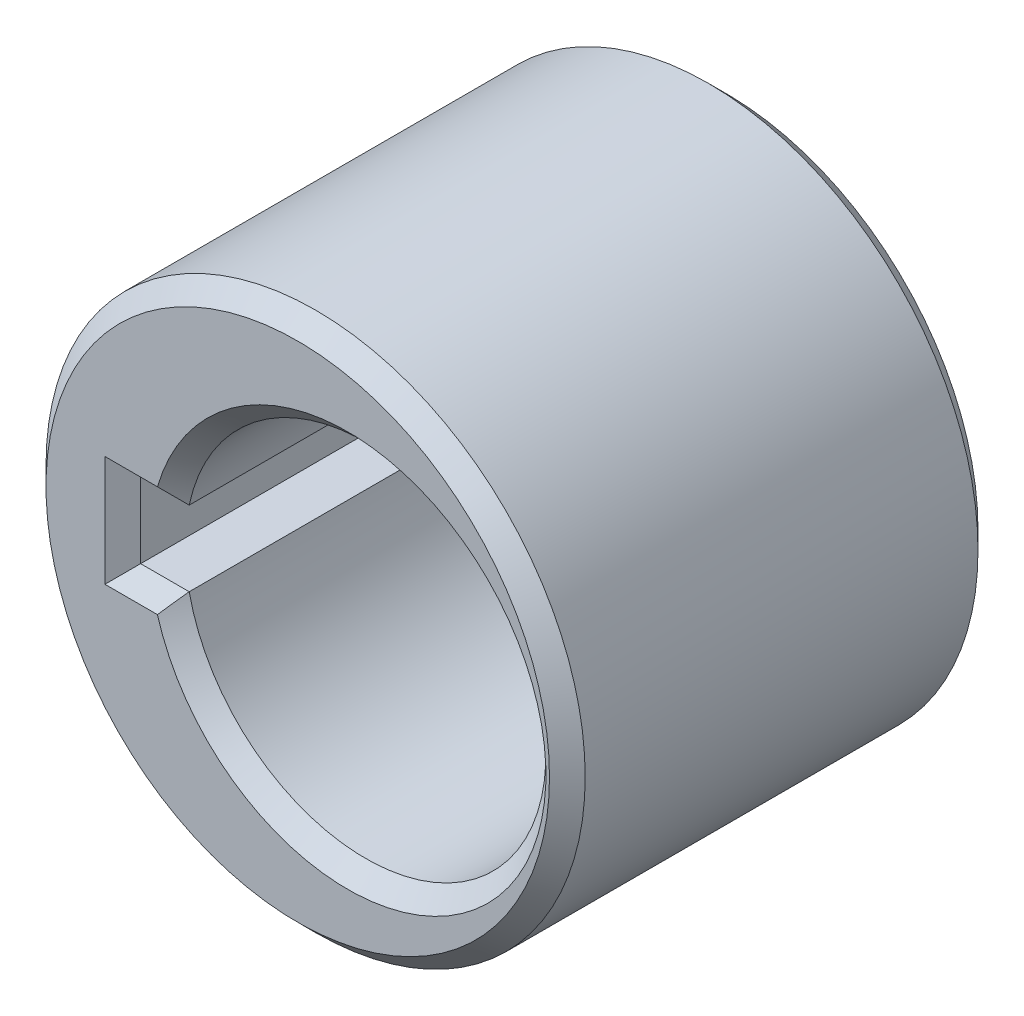
from build123d import *

# Parameters (mm, degrees)
SKETCH1_R           = 7.55
SKETCH1_R_2         = 5.05
BOSS_EXTRUDE1_DEPTH = 12
SKETCH2_W           = 6.3
SKETCH2_H           = 2.1
CUT_EXTRUDE1_DEPTH  = 17.766186209
CHAMFER1_SIZE       = 0.5
CHAMFER2_SIZE       = 0.5
CHAMFER3_SIZE       = 0.5


with BuildPart() as part:
    # Sketch1 → Boss-Extrude1 (new body)
    with BuildSketch(Plane.XY):
        with Locations((-1.4, 0)):
            Circle(SKETCH1_R)
        Circle(SKETCH1_R_2, mode=Mode.SUBTRACT)
    extrude(amount=BOSS_EXTRUDE1_DEPTH)

    # Sketch2 → Cut-Extrude1 (cut, through all)
    with BuildSketch(Plane.XY.offset(12)):
        with Locations((-3.15, 0)):
            Rectangle(SKETCH2_W, SKETCH2_H)
    extrude(amount=-CUT_EXTRUDE1_DEPTH, mode=Mode.SUBTRACT)

    # Chamfer1
    chamfer1_edges = [part.edges().sort_by_distance(p)[0] for p in [
        (-6.3, 0, 12),
        (-5.619817807, 1.05, 12),
        (-5.619817807, -1.05, 12),
        (5.05, 0, 12),
    ]]
    chamfer(chamfer1_edges, length=CHAMFER1_SIZE)

    # Chamfer2
    chamfer2_edges = [part.edges().sort_by_distance(p)[0] for p in [
        (5.05, 0, 0),
        (-5.619817807, -1.05, 0),
        (-5.619817807, 1.05, 0),
        (-6.3, 0, 0),
    ]]
    chamfer(chamfer2_edges, length=CHAMFER2_SIZE)

    # Chamfer3
    chamfer3_edges = [part.edges().sort_by_distance(p)[0] for p in [
        (-8.95, 0, 0),
        (-8.95, 0, 12),
    ]]
    chamfer(chamfer3_edges, length=CHAMFER3_SIZE)


solid = part.part
